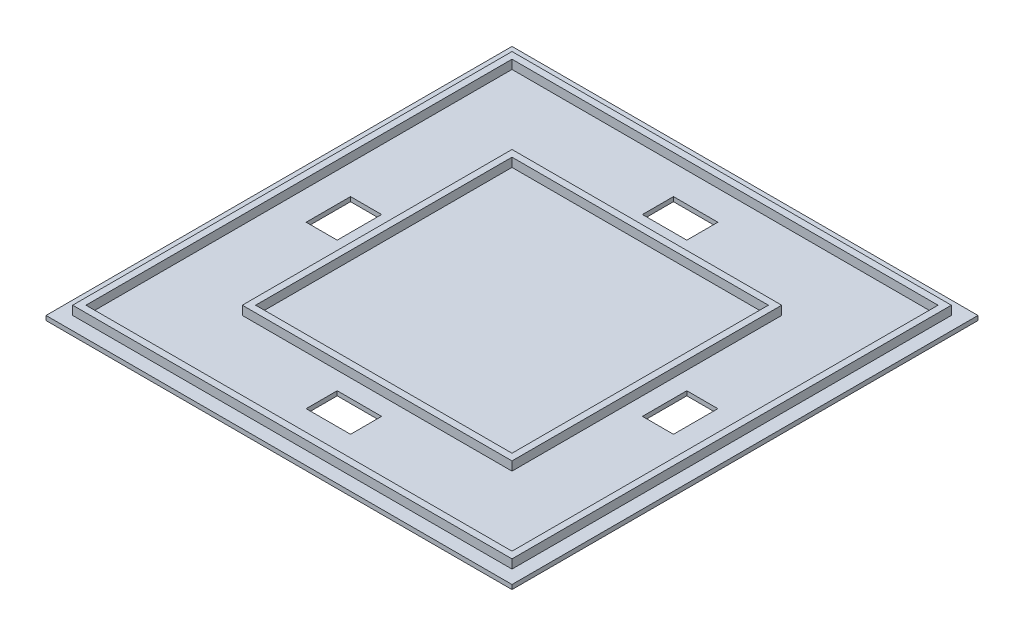
from build123d import *

# Parameters (mm, degrees)
CROQUIS1_W              = 99
CROQUIS1_H              = 99
CROQUIS1_W_2            = 96
CROQUIS1_H_2            = 96
SALIENTE_EXTRUIR1_DEPTH = 2
CROQUIS2_W              = 96
CROQUIS2_H              = 5
CROQUIS2_H_2            = 8.6
SALIENTE_EXTRUIR2_DEPTH = 1
CROQUIS3_W              = 105
CROQUIS3_H              = 105
CROQUIS3_W_2            = 99
CROQUIS3_H_2            = 99
SALIENTE_EXTRUIR3_DEPTH = 1
CROQUIS6_W              = 96
CROQUIS6_H              = 96
SALIENTE_EXTRUIR5_DEPTH = 1
CROQUIS7_W              = 60.769249784
CROQUIS7_H              = 60.769249784
CROQUIS7_W_2            = 57.769249784
CROQUIS7_H_2            = 57.769249784
SALIENTE_EXTRUIR6_DEPTH = 2
CROQUIS8_W              = 10
CROQUIS8_H              = 7
CROQUIS8_W_2            = 7
CROQUIS8_H_2            = 10
CORTAR_EXTRUIR1_DEPTH   = 65
CROQUIS9_W              = 99
CROQUIS9_H              = 99
CROQUIS9_W_2            = 96
CROQUIS9_H_2            = 96
SALIENTE_EXTRUIR7_DEPTH = 1


with BuildPart() as part:
    # Croquis1 → Saliente-Extruir1 (new body)
    with BuildSketch(Plane(origin=(0, 0, 0), x_dir=(1, 0, 0), z_dir=(0, 1, 0))):
        with Locations((49.5, 49.5)):
            Rectangle(CROQUIS1_W, CROQUIS1_H)
        with Locations((49.5, 49.5)):
            Rectangle(CROQUIS1_W_2, CROQUIS1_H_2, mode=Mode.SUBTRACT)
    extrude(amount=SALIENTE_EXTRUIR1_DEPTH)

    # Croquis2 → Saliente-Extruir2 (add)
    with BuildSketch(Plane.XZ):
        with Locations((49.5, -52)):
            Rectangle(CROQUIS2_W, CROQUIS2_H)
        with Locations((49.5, -47)):
            Rectangle(CROQUIS2_W, CROQUIS2_H)
        with Locations((49.5, -67.4)):
            Rectangle(CROQUIS2_W, CROQUIS2_H_2)
        with Locations((49.5, -84.6)):
            Rectangle(CROQUIS2_W, CROQUIS2_H_2)
        with Locations((49.5, -31.6)):
            Rectangle(CROQUIS2_W, CROQUIS2_H_2)
        with Locations((49.5, -14.4)):
            Rectangle(CROQUIS2_W, CROQUIS2_H_2)
    extrude(amount=-SALIENTE_EXTRUIR2_DEPTH)

    # Croquis3 → Saliente-Extruir3 (add)
    with BuildSketch(Plane.XZ):
        with Locations((49.5, -49.5)):
            Rectangle(CROQUIS3_W, CROQUIS3_H)
        with Locations((49.5, -49.5)):
            Rectangle(CROQUIS3_W_2, CROQUIS3_H_2, mode=Mode.SUBTRACT)
    extrude(amount=-SALIENTE_EXTRUIR3_DEPTH)

    # Croquis6 → Saliente-Extruir5 (add)
    with BuildSketch(Plane(origin=(0, 1, 0), x_dir=(1, 0, 0), z_dir=(0, 1, 0))):
        with Locations((49.5, 49.5)):
            Rectangle(CROQUIS6_W, CROQUIS6_H)
    extrude(amount=-SALIENTE_EXTRUIR5_DEPTH)

    # Croquis7 → Saliente-Extruir6 (add)
    with BuildSketch(Plane(origin=(0, 1, 0), x_dir=(1, 0, 0), z_dir=(0, 1, 0))):
        with Locations((49.5, 49.5)):
            Rectangle(CROQUIS7_W, CROQUIS7_H)
        with Locations((49.5, 49.5)):
            Rectangle(CROQUIS7_W_2, CROQUIS7_H_2, mode=Mode.SUBTRACT)
    extrude(amount=SALIENTE_EXTRUIR6_DEPTH)

    # Croquis8 → Cortar-Extruir1 (cut)
    with BuildSketch(Plane(origin=(0, 1, 0), x_dir=(1, 0, 0), z_dir=(0, 1, 0))):
        with Locations((49.5, 11.615375108)):
            Rectangle(CROQUIS8_W, CROQUIS8_H)
        with Locations((11.615375108, 49.5)):
            Rectangle(CROQUIS8_W_2, CROQUIS8_H_2)
        with Locations((49.5, 87.384624892)):
            Rectangle(CROQUIS8_W, CROQUIS8_H)
        with Locations((87.384624892, 49.5)):
            Rectangle(CROQUIS8_W_2, CROQUIS8_H_2)
    extrude(amount=-CORTAR_EXTRUIR1_DEPTH, mode=Mode.SUBTRACT)

    # Croquis9 → Saliente-Extruir7 (add)
    with BuildSketch(Plane(origin=(0, 2, 0), x_dir=(1, 0, 0), z_dir=(0, 1, 0))):
        with Locations((49.5, 49.5)):
            Rectangle(CROQUIS9_W, CROQUIS9_H)
        with Locations((49.5, 49.5)):
            Rectangle(CROQUIS9_W_2, CROQUIS9_H_2, mode=Mode.SUBTRACT)
    extrude(amount=SALIENTE_EXTRUIR7_DEPTH)


solid = part.part
